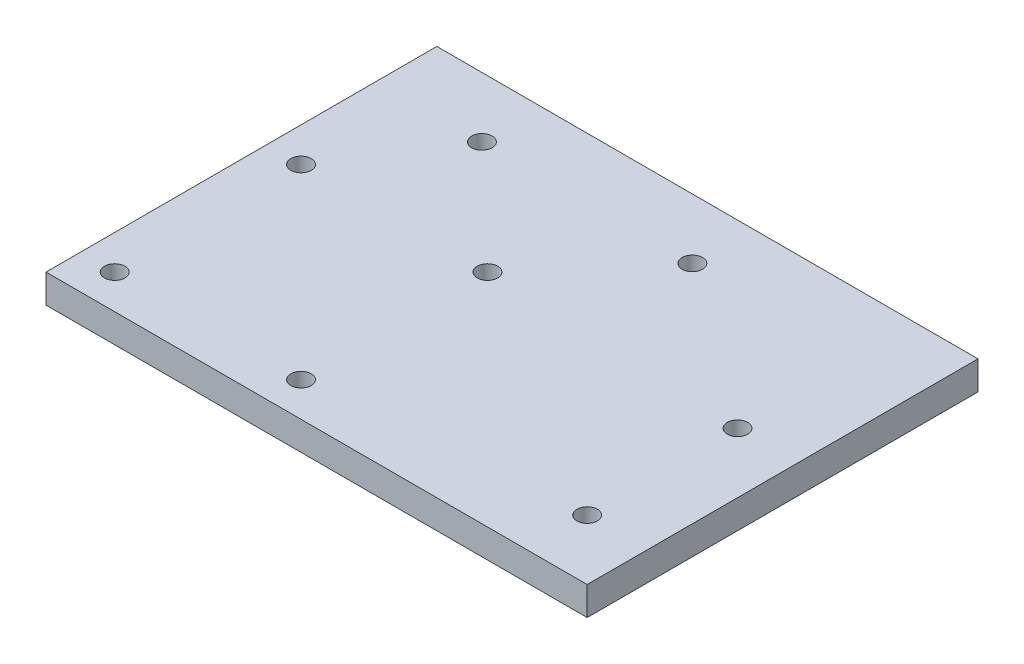
from build123d import *

# Parameters (mm, degrees)
SKETCH1_W            = 90
SKETCH1_H            = 65
BOSS_EXTRUDE1_DEPTH  = 4.7625
M3_CLEARANCE_HOLE1_D = 3.4
M3_CLEARANCE_HOLE2_D = 3.4


with BuildPart() as part:
    # Sketch1 → Boss-Extrude1 (new body)
    with BuildSketch(Plane(origin=(0, 0, 0), x_dir=(1, 0, 0), z_dir=(0, 1, 0))):
        with Locations((45, 32.5)):
            Rectangle(SKETCH1_W, SKETCH1_H)
    extrude(amount=BOSS_EXTRUDE1_DEPTH)

    # M3 Clearance Hole1 (through all)
    with Locations(Plane(origin=(0, 4.7625, 0), x_dir=(1, 0, 0), z_dir=(0, 1, 0))):
        with Locations((36.709, 5.709), (36.709, 36.709), (5.709, 36.709), (5.709, 5.709)):
            Hole(M3_CLEARANCE_HOLE1_D / 2)

    # M3 Clearance Hole2 (through all)
    with Locations(Plane(origin=(0, 0, 0), x_dir=(-1, 0, 0), z_dir=(0, -1, 0))):
        with Locations((-17.5, 55), (-52.5, 55), (-80, 35), (-80, 10)):
            Hole(M3_CLEARANCE_HOLE2_D / 2)


solid = part.part
